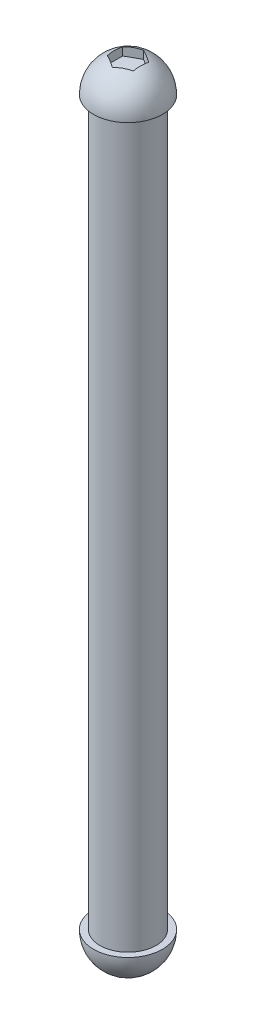
from build123d import *

# Parameters (mm, degrees)
REVOLVE_1_ANGLE     = 180
CUT_EXTRUDE_1_DEPTH = 1
SKETCH_3_R          = 2.44
EXTRUDE_1_DEPTH     = 31.5


with BuildPart() as part:
    # 草图1 → 旋转1 (revolve)
    with BuildSketch(Plane(origin=(0, 0, 0), x_dir=(1, 0, 0), z_dir=(0, 1, 0))):
        with BuildLine():
            Line((-0.227216636, -2.991383058), (0.227216636, 2.991383058))
            ThreePointArc((0.227216636, 2.991383058), (-2.991383058, 0.227216636), (-0.227216636, -2.991383058))
        make_face()
    revolve(axis=Axis((0.227216636, 0, -2.991383058), (-0.07573887865673318, 0, 0.9971276860361569)), revolution_arc=REVOLVE_1_ANGLE)

    # 草图2 → 切除-拉伸1 (cut)
    with BuildSketch(Plane(origin=(0, -3, 0), x_dir=(-1, 0, 0), z_dir=(0, -1, 0))):
        Polygon((1.161360834, -0.646595492), (1.140648539, 0.68247024), (-0.020712296, 1.329065731), (-1.161360834, 0.646595492), (-1.140648539, -0.68247024), (0.020712296, -1.329065731), align=None)
    extrude(amount=-CUT_EXTRUDE_1_DEPTH, mode=Mode.SUBTRACT)

    # 草图3 → 凸台-拉伸1 (add)
    with BuildSketch(Plane(origin=(0, 0, 0), x_dir=(1, 0, 0), z_dir=(0, 1, 0))):
        Circle(SKETCH_3_R)
    extrude(amount=EXTRUDE_1_DEPTH)

    # 镜向1: part across plane


with BuildPart() as part_1:
    add(part.part)
    add(part.part.mirror(Plane.ZX.offset(31.5)))


solid = part_1.part
